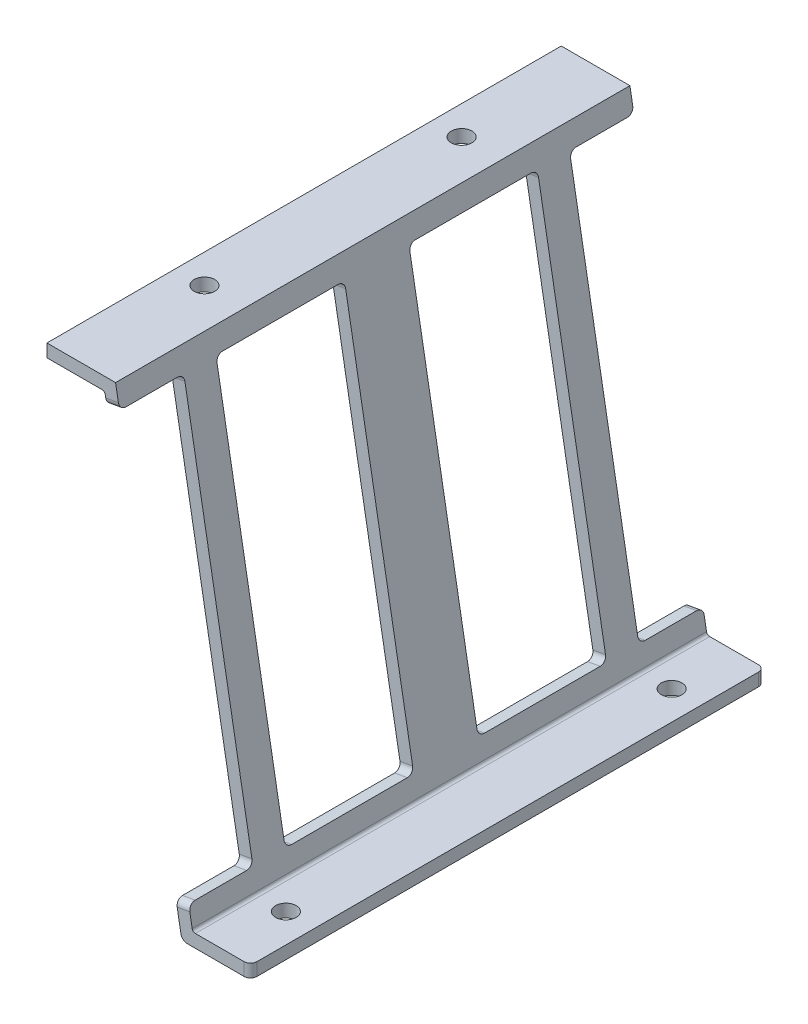
from build123d import *

# Parameters (mm, degrees)
EXTRUDE_1_DEPTH     = 80
SKETCH_2_R          = 1.6
CUT_EXTRUDE_1_DEPTH = 50
SKETCH_5_R          = 1.6
CUT_EXTRUDE_2_DEPTH = 50
SKETCH_9_W          = 10
SKETCH_9_H          = 62
SKETCH_9_W_2        = 20
CUT_EXTRUDE_6_DEPTH = 50
FILLET_1_R          = 1
FILLET_2_R          = 1
FILLET_3_R          = 1
FILLET_4_R          = 0.5
FILLET_5_R          = 0.5


with BuildPart() as part:
    # 草图1 → 凸台-拉伸1 (new body)
    with BuildSketch(Plane.XY):
        Polygon((5.79442956, 1.085282156), (17.784664248, -66.914717844), (26.784664248, -66.914717844), (26.784664248, -68.914717844), (16.106464985, -68.914717844), (4.116230297, -0.914717844), (-4.883769703, -0.914717844), (-4.883769703, 1.085282156), align=None)
    extrude(amount=EXTRUDE_1_DEPTH)

    # 草图2 → 切除-拉伸1 (cut)
    with BuildSketch(Plane(origin=(0, 1.085282156, 0), x_dir=(1, 0, 0), z_dir=(0, 1, 0))):
        with Locations(Location((-0.383769703, -20, 0), (0, 0, 270))):
            Circle(SKETCH_2_R)
        with Locations(Location((-0.383769703, -60, 0), (0, 0, 270))):
            Circle(SKETCH_2_R)
    extrude(amount=-CUT_EXTRUDE_1_DEPTH, mode=Mode.SUBTRACT)

    # 草图5 → 切除-拉伸2 (cut)
    with BuildSketch(Plane(origin=(0, -66.914717844, 0), x_dir=(1, 0, 0), z_dir=(0, 1, 0))):
        with Locations(Location((22.284664248, -10, 0), (0, 0, 270))):
            Circle(SKETCH_5_R)
        with Locations(Location((22.284664248, -70, 0), (0, 0, 270))):
            Circle(SKETCH_5_R)
    extrude(amount=-CUT_EXTRUDE_2_DEPTH, mode=Mode.SUBTRACT)

    # 草图9 → 切除-拉伸6 (cut)
    with BuildSketch(Plane(origin=(5.805300309, 1.023631076, 0), x_dir=(0, 0, -1), z_dir=(0.9848077530122086, 0.17364817766692736, 0))):
        with Locations((-75, -34.461902656)):
            Rectangle(SKETCH_9_W, SKETCH_9_H)
        with Locations((-55, -34.461902656)):
            Rectangle(SKETCH_9_W_2, SKETCH_9_H)
        with Locations((-25, -34.461902656)):
            Rectangle(SKETCH_9_W_2, SKETCH_9_H)
        with Locations((-5, -34.461902656)):
            Rectangle(SKETCH_9_W, SKETCH_9_H)
    extrude(amount=-CUT_EXTRUDE_6_DEPTH, mode=Mode.SUBTRACT)

    # 圆角1
    fillet_1_edges = [part.edges().sort_by_distance(p)[0] for p in [
        (16.106464985, -68.914717844, 40),
    ]]
    fillet(fillet_1_edges, radius=FILLET_1_R)

    # 圆角2
    fillet_2_edges = [part.edges().sort_by_distance(p)[0] for p in [
        (16.187832658, -63.617406365, 0),
        (5.421645643, -2.559325678, 0),
        (16.187832658, -63.617406365, 80),
        (5.421645643, -2.559325678, 80),
        (16.187832658, -63.617406365, 70),
        (16.187832658, -63.617406365, 65),
        (16.187832658, -63.617406365, 45),
        (16.187832658, -63.617406365, 35),
        (16.187832658, -63.617406365, 15),
        (16.187832658, -63.617406365, 10),
    ]]
    fillet(fillet_2_edges, radius=FILLET_2_R)

    # 圆角3
    fillet_3_edges = [part.edges().sort_by_distance(p)[0] for p in [
        (26.784664248, -67.914717844, 0),
        (26.784664248, -67.914717844, 80),
        (5.421645643, -2.559325678, 70),
        (5.421645643, -2.559325678, 65),
        (5.421645643, -2.559325678, 45),
        (5.421645643, -2.559325678, 35),
        (5.421645643, -2.559325678, 15),
        (5.421645643, -2.559325678, 10),
    ]]
    fillet(fillet_3_edges, radius=FILLET_3_R)

    # 圆角4
    fillet_4_edges = [part.edges().sort_by_distance(p)[0] for p in [
        (17.784664248, -66.914717844, 40),
    ]]
    fillet(fillet_4_edges, radius=FILLET_4_R)

    # 圆角5
    fillet_5_edges = [part.edges().sort_by_distance(p)[0] for p in [
        (4.116230297, -0.914717844, 40),
    ]]
    fillet(fillet_5_edges, radius=FILLET_5_R)


solid = part.part
